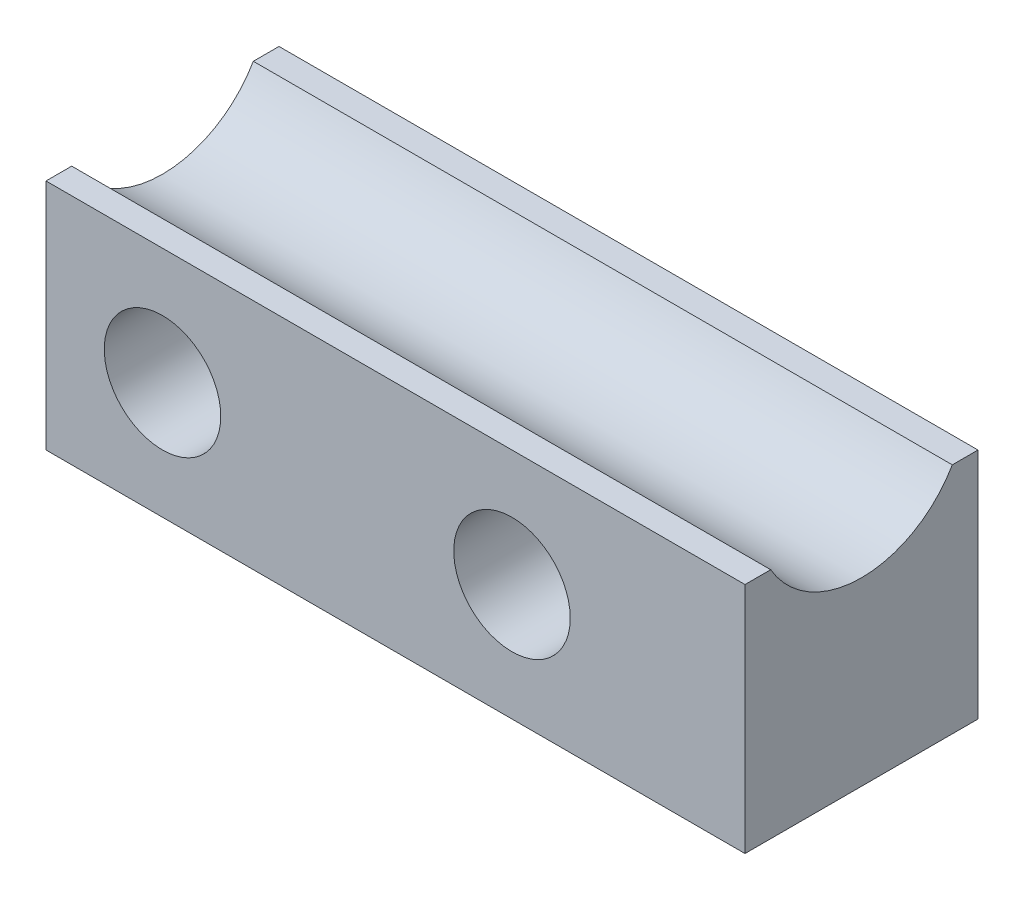
from build123d import *

# Parameters (mm, degrees)
SKETCH_1_W          = 30
SKETCH_1_H          = 10
SKETCH_1_R          = 2.5
EXTRUDE_1_DEPTH     = 10
CUT_EXTRUDE_1_REACH = 34.016
SKETCH_2_R          = 4.5


with BuildPart() as part:
    # 草圖1 → 填料-伸長1 (new body)
    with BuildSketch(Plane.XY):
        Rectangle(SKETCH_1_W, SKETCH_1_H)
        with Locations((-10, 0)):
            Circle(SKETCH_1_R, mode=Mode.SUBTRACT)
        with Locations((5, 0)):
            Circle(SKETCH_1_R, mode=Mode.SUBTRACT)
    extrude(amount=EXTRUDE_1_DEPTH)

    # 草圖2 → 除料-伸長1 (cut, up to next)
    with BuildSketch(Plane(origin=(15, 0, 0), x_dir=(0, 0, -1), z_dir=(1, 0, 0)), mode=Mode.PRIVATE) as cut_extrude_1_sk1:
        with Locations((-5, 7.25)):
            Circle(SKETCH_2_R)
    cut_extrude_1_tool1 = extrude(cut_extrude_1_sk1.sketch, amount=-CUT_EXTRUDE_1_REACH, mode=Mode.PRIVATE) & part.part
    add(cut_extrude_1_tool1.solids().sort_by_distance((15, 7.25, 5))[0], mode=Mode.SUBTRACT)


solid = part.part
